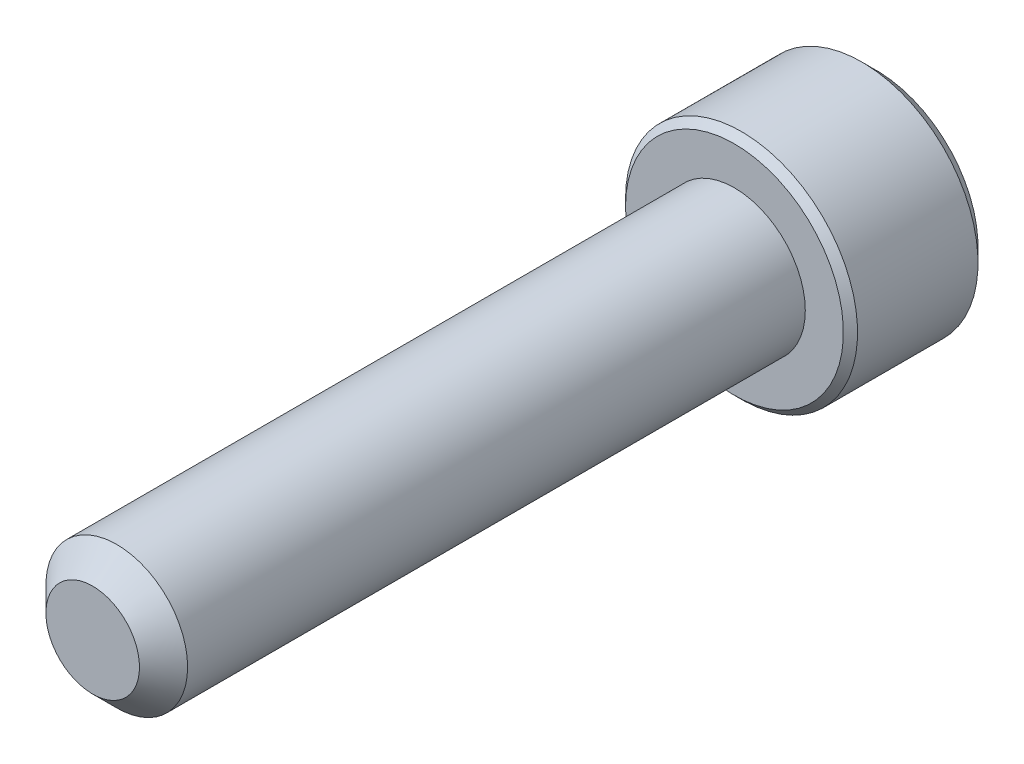
from build123d import *

# Parameters (mm, degrees)
SKETCH1_R          = 1.7526
EXTRUDE1_DEPTH     = 15.875
CHAMFER3_SIZE      = 0.5953125
SKETCH6_R          = 2.8702
EXTRUDE2_DEPTH     = 3.5052
CUT_EXTRUDE1_DEPTH = 2.08359375
SKETCH8_R          = 1.603951217
CUT_EXTRUDE2_DEPTH = 0.35052
CUT_EXTRUDE2_DRAFT = -45
CHAMFER1_SIZE      = 0.35052
CHAMFER2_SIZE      = 0.17526


with BuildPart() as part:
    # Sketch1 → Extrude1 (new body)
    with BuildSketch(Plane.XY):
        Circle(SKETCH1_R)
    extrude(amount=-EXTRUDE1_DEPTH)

    # Chamfer3
    chamfer3_edges = [part.edges().sort_by_distance(p)[0] for p in [
        (-1.7526, 0, 0),
    ]]
    chamfer(chamfer3_edges, length=CHAMFER3_SIZE)

    # Sketch6 → Extrude2 (add)
    with BuildSketch(Plane(origin=(0, 0, -15.875), x_dir=(-1, 0, 0), z_dir=(0, 0, -1))):
        Circle(SKETCH6_R)
    extrude(amount=EXTRUDE2_DEPTH)

    # Sketch7 → Cut-Extrude1 (cut)
    with BuildSketch(Plane(origin=(0, 0, -19.3802), x_dir=(-1, 0, 0), z_dir=(0, 0, -1))):
        Polygon((0, 1.603951217), (-1.3890625, 0.801975608), (-1.3890625, -0.801975608), (0, -1.603951217), (1.3890625, -0.801975608), (1.3890625, 0.801975608), align=None)
    extrude(amount=-CUT_EXTRUDE1_DEPTH, mode=Mode.SUBTRACT)


with BuildPart() as cut_extrude2_tool:
    # Sketch8 → Cut-Extrude2 (with draft: the straight prism first)
    with BuildSketch(Plane(origin=(0, 0, -19.3802), x_dir=(-1, 0, 0), z_dir=(0, 0, -1))):
        Circle(SKETCH8_R)
    extrude(amount=-CUT_EXTRUDE2_DEPTH)
    # Cut-Extrude2: the draft: its side faces are tilted about the plane it starts from
    cut_extrude2_sides = [cut_extrude2_tool.faces().sort_by_distance(p)[0] for p in [
        (1.603951217, 0, -19.20494),
    ]]
    draft(cut_extrude2_sides, Plane(origin=(0, 0, -19.3802), x_dir=(-1, 0, 0), z_dir=(0, 0, -1)), CUT_EXTRUDE2_DRAFT)


with BuildPart() as part_1:
    add(part.part)

    # Cut-Extrude2: cut by cut_extrude2_tool
    add(cut_extrude2_tool.part, mode=Mode.SUBTRACT)

    # Chamfer1
    chamfer1_edges = [part_1.edges().sort_by_distance(p)[0] for p in [
        (2.8702, 0, -19.3802),
    ]]
    chamfer(chamfer1_edges, length=CHAMFER1_SIZE)

    # Chamfer2
    chamfer2_edges = [part_1.edges().sort_by_distance(p)[0] for p in [
        (2.8702, 0, -15.875),
    ]]
    chamfer(chamfer2_edges, length=CHAMFER2_SIZE)


solid = part_1.part
